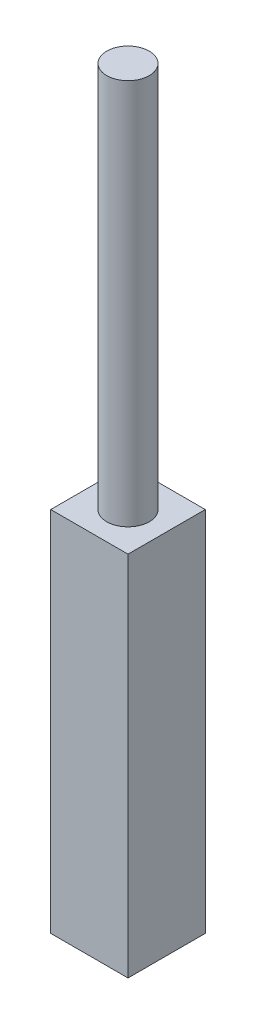
from build123d import *

# Parameters (mm, degrees)
SKETCH1_W           = 2.54
SKETCH1_H           = 2.54
BOSS_EXTRUDE1_DEPTH = 12.065
SKETCH2_R           = 0.6985
BOSS_EXTRUDE2_DEPTH = 12.7


with BuildPart() as part:
    # Sketch1 → Boss-Extrude1 (new body)
    with BuildSketch(Plane(origin=(0, 0, 0), x_dir=(1, 0, 0), z_dir=(0, 1, 0))):
        Rectangle(SKETCH1_W, SKETCH1_H)
    extrude(amount=BOSS_EXTRUDE1_DEPTH)

    # Sketch2 → Boss-Extrude2 (add)
    with BuildSketch(Plane(origin=(0, 12.065, 0), x_dir=(1, 0, 0), z_dir=(0, 1, 0))):
        with Locations(Location((0, 0, 0), (0, 0, 270))):
            Circle(SKETCH2_R)
    extrude(amount=BOSS_EXTRUDE2_DEPTH)


solid = part.part
